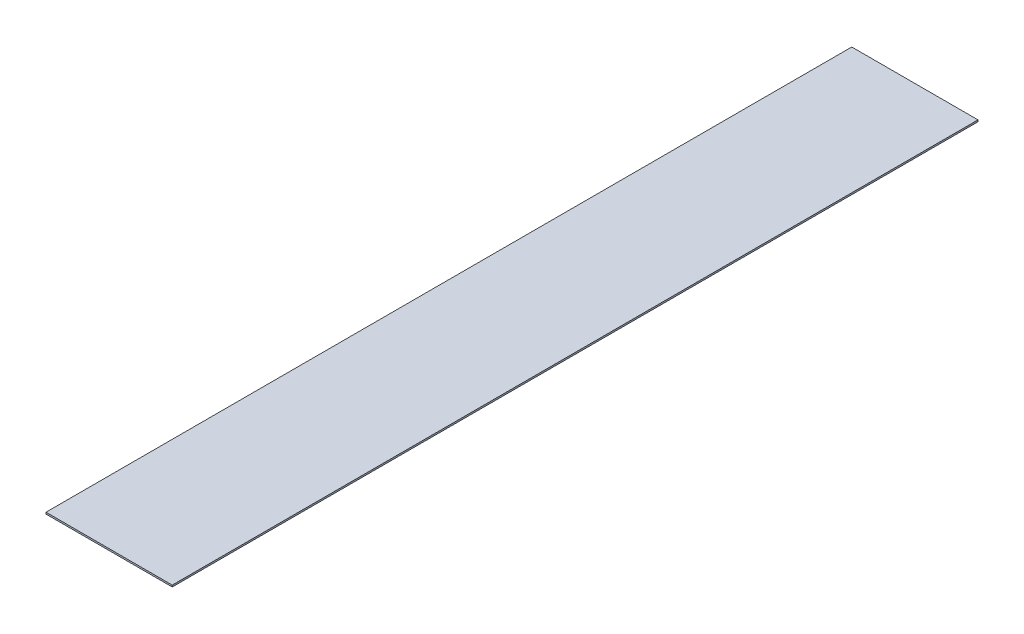
from build123d import *

# Parameters (mm, degrees)
SKETCH2_W           = 3760
SKETCH2_H           = 24000
BOSS_EXTRUDE1_DEPTH = 50


with BuildPart() as part:
    # Sketch2 → Boss-Extrude1 (new body)
    with BuildSketch(Plane(origin=(0, 0, 0), x_dir=(1, 0, 0), z_dir=(0, 1, 0))):
        Rectangle(SKETCH2_W, SKETCH2_H)
    extrude(amount=BOSS_EXTRUDE1_DEPTH)


solid = part.part
